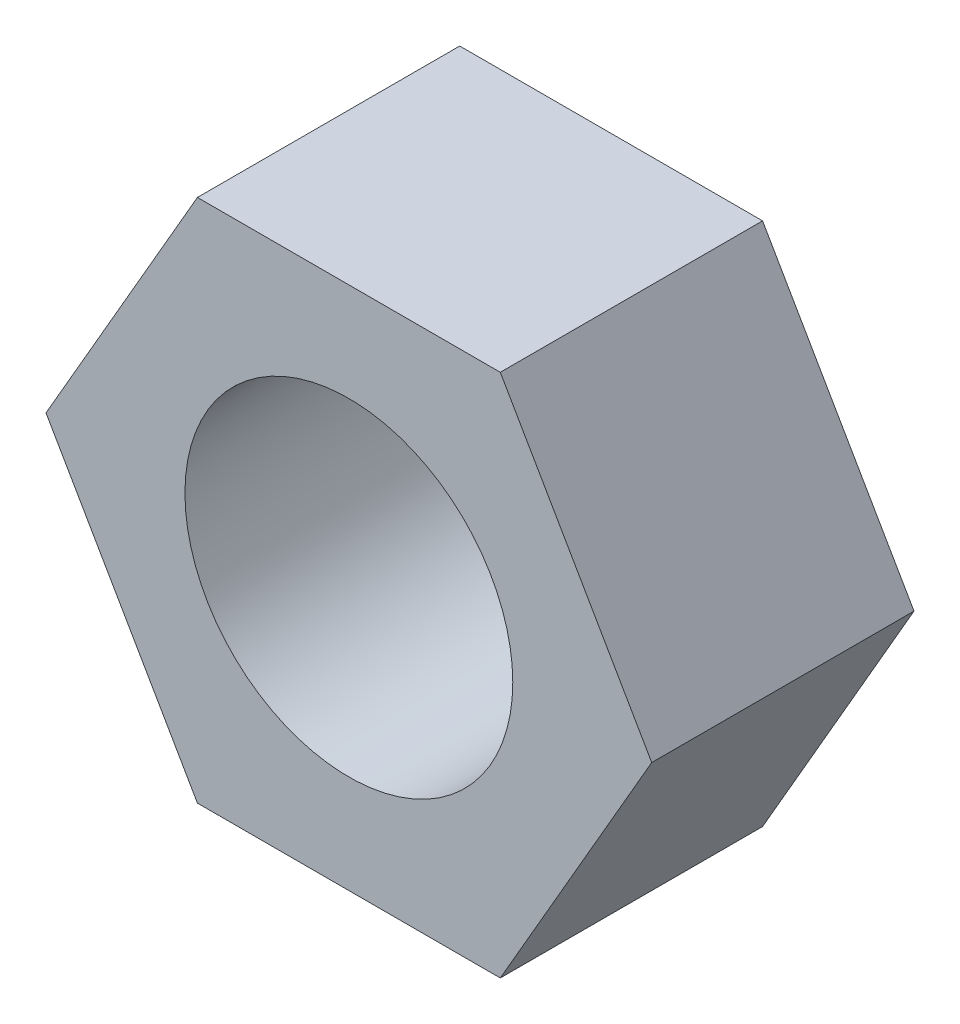
from build123d import *

# Parameters (mm, degrees)
SKETCH1_R                       = 2.5
NUT_THREAD_MAJOR_ENVELOPE_DEPTH = 4


with BuildPart() as part:
    # Sketch1 → Nut_Thread_Major_Envelope (new body)
    with BuildSketch(Plane.XY):
        Polygon((4.618802154, 0), (2.309401077, 4), (-2.309401077, 4), (-4.618802154, 0), (-2.309401077, -4), (2.309401077, -4), align=None)
        Circle(SKETCH1_R, mode=Mode.SUBTRACT)
    extrude(amount=NUT_THREAD_MAJOR_ENVELOPE_DEPTH)


solid = part.part
